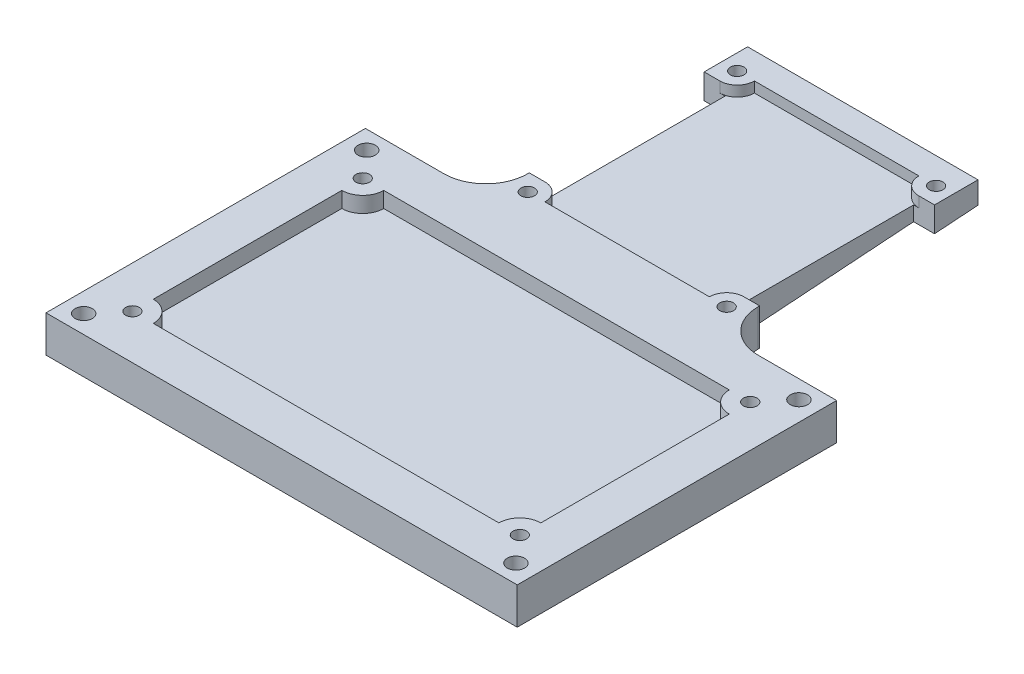
from build123d import *

# Parameters (mm, degrees)
SKETCH1_R           = 1.65
BOSS_EXTRUDE1_DEPTH = 7
CHAMFER1_SIZE       = 40
CHAMFER1_SIZE2      = 2.797072478
SKETCH2_R           = 1.3
CUT_EXTRUDE1_DEPTH  = 144.073407732
SKETCH3_R           = 1.3
CUT_EXTRUDE2_DEPTH  = 144.073407732
CUT_EXTRUDE3_DEPTH  = 3
CUT_EXTRUDE4_DEPTH  = 2
SKETCH6_W           = 4
SKETCH6_H           = 33.4
CUT_EXTRUDE5_DEPTH  = 144.073407732


with BuildPart() as part:
    # Sketch1 → Boss-Extrude1 (new body)
    with BuildSketch(Plane(origin=(0, 0, 0), x_dir=(1, 0, 0), z_dir=(0, 1, 0))):
        with BuildLine():
            Line((0, 0), (90, 0))
            Line((90, 0), (90, 61))
            Line((90, 61), (75, 61))
            ThreePointArc((75, 61), (69.343145751, 63.343145751), (67, 69))
            Line((67, 69), (67, 111))
            Line((67, 111), (23, 111))
            Line((23, 111), (23, 69))
            ThreePointArc((23, 69), (20.656854249, 63.343145751), (15, 61))
            Line((15, 61), (0, 61))
            Line((0, 61), (0, 0))
        make_face()
        with Locations(Location((3.725, 57.525, 0), (0, 0, 270))):
            Circle(SKETCH1_R, mode=Mode.SUBTRACT)
        with Locations(Location((86.275, 57.525, 0), (0, 0, 270))):
            Circle(SKETCH1_R, mode=Mode.SUBTRACT)
        with Locations(Location((86.275, 3.475, 0), (0, 0, 270))):
            Circle(SKETCH1_R, mode=Mode.SUBTRACT)
        with Locations(Location((3.725, 3.475, 0), (0, 0, 270))):
            Circle(SKETCH1_R, mode=Mode.SUBTRACT)
    extrude(amount=BOSS_EXTRUDE1_DEPTH)

    # Chamfer1
    chamfer1_edges = [part.edges().sort_by_distance(p)[0] for p in [
        (45, 0, -111),
    ]]
    chamfer1_side = [part.faces().sort_by_distance(p)[0] for p in [
        (45, 0, -46.507129493),
    ]]
    chamfer(chamfer1_edges, length=CHAMFER1_SIZE, length2=CHAMFER1_SIZE2, reference=chamfer1_side[0])

    # Sketch2 → Cut-Extrude1 (cut, through all)
    with BuildSketch(Plane(origin=(0, 7, 0), x_dir=(1, 0, 0), z_dir=(0, 1, 0))):
        with Locations(Location((8, 52.5, 0), (0, 0, 270))):
            Circle(SKETCH2_R)
        with Locations(Location((8, 8.5, 0), (0, 0, 270))):
            Circle(SKETCH2_R)
        with Locations(Location((82, 52.5, 0), (0, 0, 270))):
            Circle(SKETCH2_R)
        with Locations(Location((82, 8.5, 0), (0, 0, 270))):
            Circle(SKETCH2_R)
    extrude(amount=-CUT_EXTRUDE1_DEPTH, mode=Mode.SUBTRACT)

    # Sketch3 → Cut-Extrude2 (cut, through all)
    with BuildSketch(Plane(origin=(0, 7, 0), x_dir=(1, 0, 0), z_dir=(0, 1, 0))):
        with Locations(Location((26, 106, 0), (0, 0, 270))):
            Circle(SKETCH3_R)
        with Locations(Location((64, 106, 0), (0, 0, 270))):
            Circle(SKETCH3_R)
        with Locations(Location((26, 66, 0), (0, 0, 270))):
            Circle(SKETCH3_R)
        with Locations(Location((64, 66, 0), (0, 0, 270))):
            Circle(SKETCH3_R)
    extrude(amount=-CUT_EXTRUDE2_DEPTH, mode=Mode.SUBTRACT)

    # Sketch4 → Cut-Extrude3 (cut)
    with BuildSketch(Plane(origin=(0, 7, 0), x_dir=(1, 0, 0), z_dir=(0, 1, 0))):
        with BuildLine():
            Line((12, 52.5), (78, 52.5))
            ThreePointArc((78, 52.5), (79.171572875, 49.671572875), (82, 48.5))
            Line((82, 48.5), (82, 12.5))
            ThreePointArc((82, 12.5), (79.171572875, 11.328427125), (78, 8.5))
            Line((78, 8.5), (12, 8.5))
            ThreePointArc((12, 8.5), (10.828427125, 11.328427125), (8, 12.5))
            Line((8, 12.5), (8, 48.5))
            ThreePointArc((8, 48.5), (10.828427125, 49.671572875), (12, 52.5))
        make_face()
    extrude(amount=-CUT_EXTRUDE3_DEPTH, mode=Mode.SUBTRACT)

    # Sketch5 → Cut-Extrude4 (cut)
    with BuildSketch(Plane(origin=(0, 7, 0), x_dir=(1, 0, 0), z_dir=(0, 1, 0))):
        with BuildLine():
            Line((29.3, 106), (60.7, 106))
            ThreePointArc((60.7, 106), (61.666547622, 103.666547622), (64, 102.7))
            Line((64, 102.7), (64, 69.3))
            ThreePointArc((64, 69.3), (61.666547622, 68.333452378), (60.7, 66))
            Line((60.7, 66), (29.3, 66))
            ThreePointArc((29.3, 66), (28.333452378, 68.333452378), (26, 69.3))
            Line((26, 69.3), (26, 102.7))
            ThreePointArc((26, 102.7), (28.333452378, 103.666547622), (29.3, 106))
        make_face()
    extrude(amount=-CUT_EXTRUDE4_DEPTH, mode=Mode.SUBTRACT)

    # Sketch6 → Cut-Extrude5 (cut, through all)
    with BuildSketch(Plane(origin=(0, 7, 0), x_dir=(1, 0, 0), z_dir=(0, 1, 0))):
        with Locations((25, 86)):
            Rectangle(SKETCH6_W, SKETCH6_H)
        with Locations((65, 86)):
            Rectangle(SKETCH6_W, SKETCH6_H)
    extrude(amount=-CUT_EXTRUDE5_DEPTH, mode=Mode.SUBTRACT)


solid = part.part
